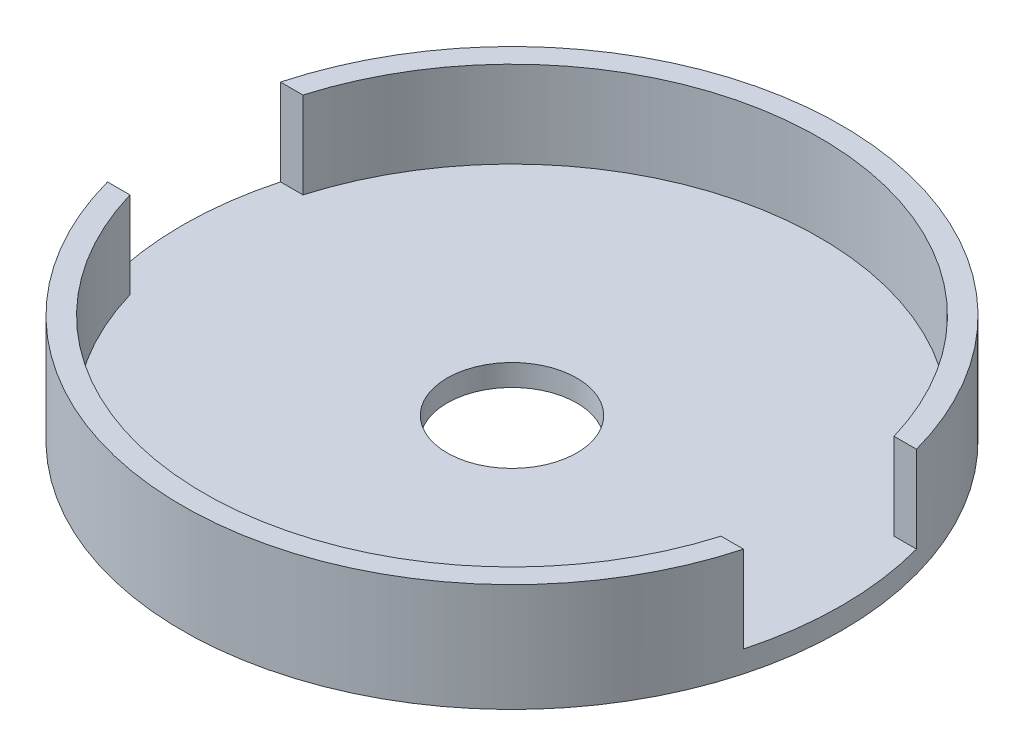
from build123d import *

# Parameters (mm, degrees)
CUT_EXTRUDE2_DEPTH      = 111.624951977
CUT_EXTRUDE2_DEPTH_BACK = 111.624951977
SKETCH2_W               = 40
SKETCH2_H               = 20
CUT_EXTRUDE3_DEPTH      = 110.603284622
CUT_EXTRUDE3_DEPTH_BACK = 110.603284622
SKETCH3_R               = 15


with BuildPart() as part:
    # Sketch1 → Revolve1 (revolve)
    with BuildSketch(Plane.XY):
        Polygon((0, 0), (-76.2, 0), (-76.2, 25), (-71.2, 25), (-71.2, 5), (0, 5), align=None)
    revolve(axis=Axis((0, 5, 0), (0, -1, 0)))

    # Sketch2 → Cut-Extrude2 (cut, two sides: drawn at the far end of the back side and taken through both)
    with BuildSketch(Plane(origin=(0, 0, 0), x_dir=(0, 0, -1), z_dir=(1, 0, 0)).offset(-CUT_EXTRUDE2_DEPTH_BACK)):
        with Locations((0, 15)):
            Rectangle(SKETCH2_W, SKETCH2_H)
    extrude(amount=CUT_EXTRUDE2_DEPTH + CUT_EXTRUDE2_DEPTH_BACK, mode=Mode.SUBTRACT)

    # Sketch3 → Cut-Extrude3 (cut, two sides: drawn at the far end of the back side and taken through both)
    with BuildSketch(Plane(origin=(0, 5, 0), x_dir=(1, 0, 0), z_dir=(0, 1, 0)).offset(-CUT_EXTRUDE3_DEPTH_BACK)):
        with Locations(Location((0, 0, 0), (0, 0, 180))):
            Circle(SKETCH3_R)
    extrude(amount=CUT_EXTRUDE3_DEPTH + CUT_EXTRUDE3_DEPTH_BACK, mode=Mode.SUBTRACT)


solid = part.part
